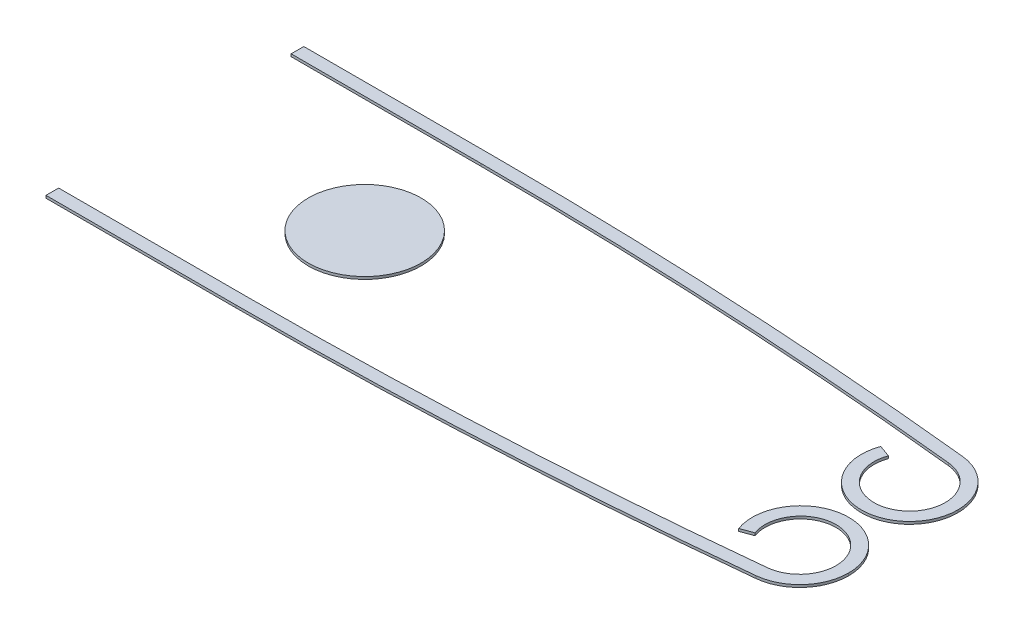
from build123d import *

# Parameters (mm, degrees)
SKETCH1_R             = 22.3
BOSS_EXTRUDE1_DEPTH   = 0.5
BOSS_EXTRUDE1_2_DEPTH = 0.5
BOSS_EXTRUDE1_3_DEPTH = 0.5


with BuildPart() as part:
    # Sketch1 → Boss-Extrude1 (new, symmetric)
    with BuildSketch(Plane(origin=(0, 0, 0), x_dir=(1, 0, 0), z_dir=(0, 1, 0))):
        with Locations(Location((0, 0, 0), (0, 0, 270))):
            Circle(SKETCH1_R)
    extrude(amount=BOSS_EXTRUDE1_DEPTH, both=True)


with BuildPart() as body_2:
    # Sketch1 → Boss-Extrude1 2 (new, symmetric)
    with BuildSketch(Plane(origin=(0, 0, 0), x_dir=(1, 0, 0), z_dir=(0, 1, 0))):
        with BuildLine():
            Line((0, 50.931890821), (-75, 50.931890821))
            Line((-75, 50.931890821), (-75, 45.931890821))
            Line((-75, 45.931890821), (0, 45.931890821))
            ThreePointArc((0, 45.931890821), (97.59386772, 43.404960787), (194.92619862, 35.830942477))
            ThreePointArc((194.92619862, 35.830942477), (204.106473558, 31.16353317), (207.8, 21.55))
            ThreePointArc((207.8, 21.55), (191.310601503, 7.71338788), (180.547069755, 26.354699048))
            Line((180.547069755, 26.354699048), (175.848518066, 28.06455636))
            ThreePointArc((175.848518066, 28.06455636), (190.442488159, 2.789326627), (212.8, 21.55))
            ThreePointArc((212.8, 21.55), (207.820233688, 34.511366155), (195.443004341, 40.804161942))
            ThreePointArc((195.443004341, 40.804161942), (97.852617285, 48.398261165), (0, 50.931890821))
        make_face()
    extrude(amount=BOSS_EXTRUDE1_2_DEPTH, both=True)


with BuildPart() as body_3:
    # Sketch1 → Boss-Extrude1 3 (new, symmetric)
    with BuildSketch(Plane(origin=(0, 0, 0), x_dir=(1, 0, 0), z_dir=(0, 1, 0))):
        with BuildLine():
            Line((180.547069755, -26.354699048), (175.848518066, -28.06455636))
            ThreePointArc((175.848518066, -28.06455636), (190.442488159, -2.789326627), (212.8, -21.55))
            ThreePointArc((212.8, -21.55), (207.820233688, -34.511366155), (195.443004341, -40.804161942))
            ThreePointArc((195.443004341, -40.804161942), (97.852617285, -48.398261165), (0, -50.931890821))
            Line((0, -50.931890821), (-75, -50.931890821))
            Line((-75, -50.931890821), (-75, -45.931890821))
            Line((-75, -45.931890821), (0, -45.931890821))
            ThreePointArc((0, -45.931890821), (97.59386772, -43.404960787), (194.92619862, -35.830942477))
            ThreePointArc((194.92619862, -35.830942477), (204.106473558, -31.16353317), (207.8, -21.55))
            ThreePointArc((207.8, -21.55), (191.310601503, -7.71338788), (180.547069755, -26.354699048))
        make_face()
    extrude(amount=BOSS_EXTRUDE1_3_DEPTH, both=True)


solid = Compound([part.part, body_2.part, body_3.part])
